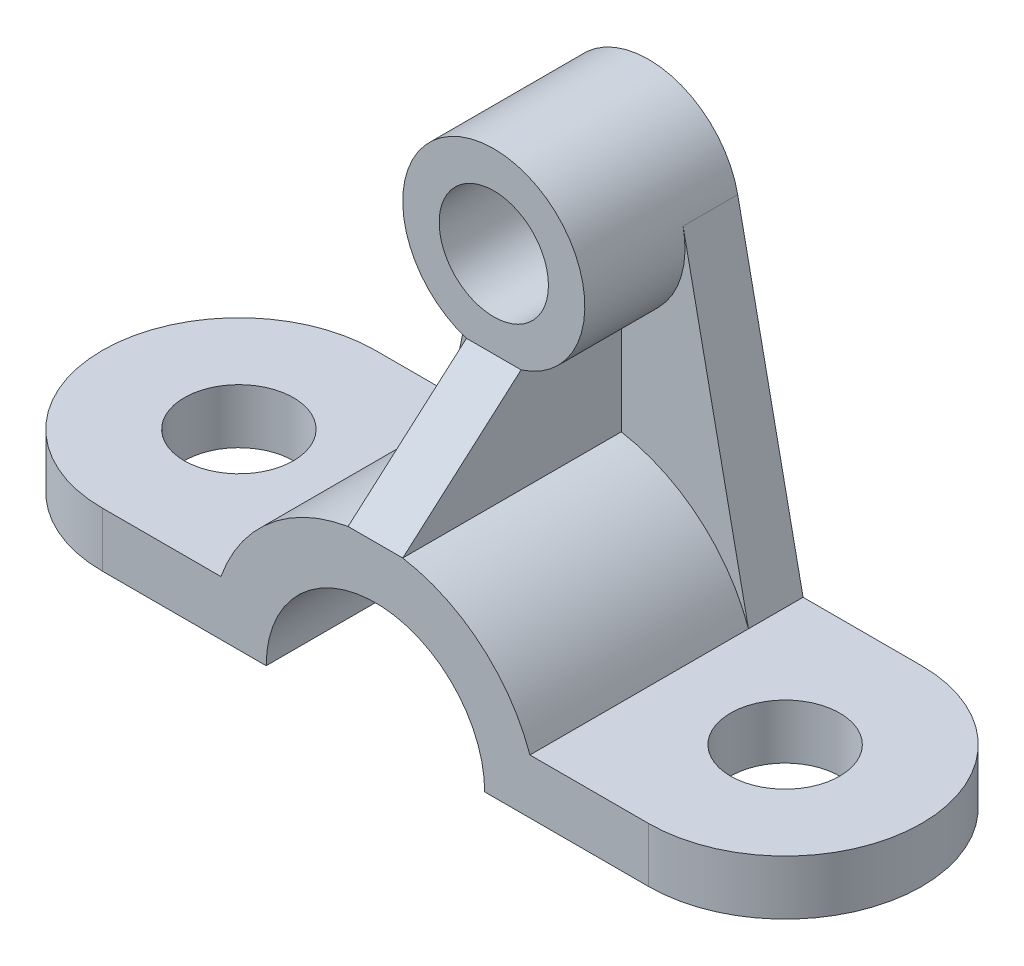
from build123d import *

# Parameters (mm, degrees)
Y_KSEKLIK_EKSTR_ZYON1_DEPTH = 60
RADYUS1_RADIUS              = 30
RADYUS1_LENGTH              = 12
RADYUS2_RADIUS              = 30
RADYUS2_LENGTH              = 12
IZIM3_R                     = 12
KES_EKSTR_ZYON1_DEPTH       = 181.906004531
Y_KSEKLIK_EKSTR_ZYON2_DEPTH = 12
IZIM5_R                     = 20
IZIM5_R_2                   = 12
Y_KSEKLIK_EKSTR_ZYON3_DEPTH = 22
IZIM7_W                     = 12
IZIM7_H                     = 29.711788784
Y_KSEKLIK_EKSTR_ZYON6_DEPTH = 48
KES_EKSTR_ZYON2_DEPTH       = 162.92325206
IZIM9_R                     = 24
KES_EKSTR_ZYON3_DEPTH       = 211.376144164


with BuildPart() as part:
    # Çizim1 → Yükseklik-Ekstrüzyon1 (new body)
    with BuildSketch(Plane.XY):
        with BuildLine():
            Line((-102.970359754, 18.398808471), (-168.970359754, 18.398808471))
            Line((-168.970359754, 18.398808471), (-168.970359754, 30.398808471))
            Line((-168.970359754, 30.398808471), (-112.911485251, 30.398808471))
            ThreePointArc((-112.911485251, 30.398808471), (-78.970359754, 54.398808471), (-45.029234257, 30.398808471))
            Line((-45.029234257, 30.398808471), (11.029640246, 30.398808471))
            Line((11.029640246, 30.398808471), (11.029640246, 18.398808471))
            Line((11.029640246, 18.398808471), (-54.970359754, 18.398808471))
            ThreePointArc((-54.970359754, 18.398808471), (-78.970359754, 42.398808471), (-102.970359754, 18.398808471))
        make_face()
    extrude(amount=Y_KSEKLIK_EKSTR_ZYON1_DEPTH)

    # Radyus1: full round fillet: the end face becomes a half cylinder, R = half its width
    radyus1_face = Plane((-168.970359754, 24.398808471, 30), x_dir=(0, 1, 0), z_dir=(-1, 0, 0))  # on the end face: x along it, z out of the body
    radyus1_slab = radyus1_face.offset(-RADYUS1_RADIUS / 2) * Box(RADYUS1_LENGTH, 2 * RADYUS1_RADIUS, RADYUS1_RADIUS, mode=Mode.PRIVATE)  # the body's end, R deep
    radyus1_round = Plane((-138.970359754, 24.398808471, 30), x_dir=(-1, 0, 0), z_dir=(0, 1, 0)) * Cylinder(RADYUS1_RADIUS, RADYUS1_LENGTH, mode=Mode.PRIVATE)  # its axis R under the face
    add(radyus1_slab - radyus1_round, mode=Mode.SUBTRACT)

    # Radyus2: full round fillet: the end face becomes a half cylinder, R = half its width
    radyus2_face = Plane((11.029640246, 24.398808471, 30), x_dir=(0, 1, 0), z_dir=(1, 0, 0))  # on the end face: x along it, z out of the body
    radyus2_slab = radyus2_face.offset(-RADYUS2_RADIUS / 2) * Box(RADYUS2_LENGTH, 2 * RADYUS2_RADIUS, RADYUS2_RADIUS, mode=Mode.PRIVATE)  # the body's end, R deep
    radyus2_round = Plane((-18.970359754, 24.398808471, 30), x_dir=(1, 0, 0), z_dir=(0, 1, 0)) * Cylinder(RADYUS2_RADIUS, RADYUS2_LENGTH, mode=Mode.PRIVATE)  # its axis R under the face
    add(radyus2_slab - radyus2_round, mode=Mode.SUBTRACT)

    # Çizim3 → Kes-Ekstrüzyon1 (cut, through all)
    with BuildSketch(Plane(origin=(0, 30.398808471, 0), x_dir=(1, 0, 0), z_dir=(0, 1, 0))):
        with Locations(Location((-138.970359754, -30, 0), (0, 0, 270))):
            Circle(IZIM3_R)
        with Locations(Location((-18.970359754, -30, 0), (0, 0, 270))):
            Circle(IZIM3_R)
    extrude(amount=-KES_EKSTR_ZYON1_DEPTH, mode=Mode.SUBTRACT)

    # Çizim4 → Yükseklik-Ekstrüzyon2 (add)
    with BuildSketch(Plane(origin=(0, 0, 0), x_dir=(-1, 0, 0), z_dir=(0, 0, -1))):
        with BuildLine():
            Line((59.384707946, 99.821897357), (45.029234257, 30.398808471))
            Line((45.029234257, 30.398808471), (45.029234257, 18.398808471))
            Line((45.029234257, 18.398808471), (112.911485251, 18.398808471))
            Line((112.911485251, 18.398808471), (112.911485251, 30.398808471))
            Line((112.911485251, 30.398808471), (98.556011563, 99.821897357))
            ThreePointArc((98.556011563, 99.821897357), (78.970359754, 115.771929058), (59.384707946, 99.821897357))
        make_face()
    extrude(amount=-Y_KSEKLIK_EKSTR_ZYON2_DEPTH)

    # Çizim5 → Yükseklik-Ekstrüzyon3 (add)
    with BuildSketch(Plane.XY.offset(12)):
        with Locations(Location((-78.970359754, 95.771929058, 0), (0, 0, 168.316902305))):
            Circle(IZIM5_R)
        with Locations((-78.970359754, 95.771929058)):
            Circle(IZIM5_R_2, mode=Mode.SUBTRACT)
    extrude(amount=Y_KSEKLIK_EKSTR_ZYON3_DEPTH)

    # Çizim7 → Yükseklik-Ekstrüzyon6 (add)
    with BuildSketch(Plane.XY.offset(12)):
        with Locations((-78.970359754, 64.368074617)):
            Rectangle(IZIM7_W, IZIM7_H)
    extrude(amount=Y_KSEKLIK_EKSTR_ZYON6_DEPTH)

    # Çizim8 → Kes-Ekstrüzyon2 (cut, through all)
    with BuildSketch(Plane.ZY.offset(84.970359754)):
        Polygon((34, 76.693145029), (34, 79.223969009), (60, 79.223969009), (60, 53.895287169), align=None)
    extrude(amount=-KES_EKSTR_ZYON2_DEPTH, mode=Mode.SUBTRACT)

    # Çizim9 → Kes-Ekstrüzyon3 (cut, through all)
    with BuildSketch(Plane.XY.offset(12)):
        with Locations((-78.970359754, 18.398808471)):
            Circle(IZIM9_R)
    extrude(amount=-KES_EKSTR_ZYON3_DEPTH, mode=Mode.SUBTRACT)


solid = part.part
